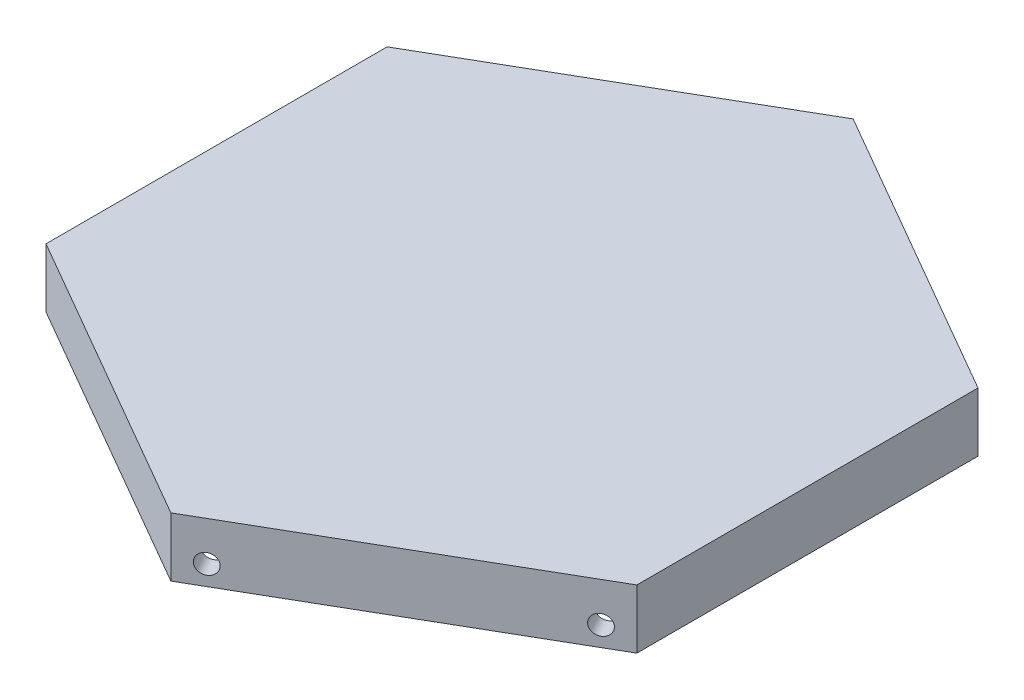
from build123d import *

# Parameters (mm, degrees)
BOSS_EXTRUDE2_DEPTH = 9
CUT_EXTRUDE3_DEPTH  = 6
SKETCH5_R           = 1.5
CUT_EXTRUDE7_DEPTH  = 5
SKETCH7_R           = 1.5
CUT_EXTRUDE8_DEPTH  = 5
SKETCH8_R           = 1.5
CUT_EXTRUDE9_DEPTH  = 5


with BuildPart() as part:
    # Sketch1 → Boss-Extrude2 (new body)
    with BuildSketch(Plane(origin=(0, 0, 0), x_dir=(1, 0, 0), z_dir=(0, 1, 0))):
        Polygon((0, 51.961524227), (-45, 25.980762114), (-45, -25.980762114), (0, -51.961524227), (45, -25.980762114), (45, 25.980762114), align=None)
    extrude(amount=BOSS_EXTRUDE2_DEPTH)

    # Sketch4 → Cut-Extrude3 (cut)
    with BuildSketch(Plane.XZ):
        Polygon((0, 48.497422612), (-42, 24.248711306), (-42, -24.248711306), (0, -48.497422612), (42, -24.248711306), (42, 24.248711306), align=None)
    extrude(amount=-CUT_EXTRUDE3_DEPTH, mode=Mode.SUBTRACT)

    # Sketch5 → Cut-Extrude7 (cut)
    with BuildSketch(Plane.ZY.offset(45)):
        with Locations((-21.980762114, 3)):
            Circle(SKETCH5_R)
        with Locations((21.980762114, 3)):
            Circle(SKETCH5_R)
    extrude(amount=-CUT_EXTRUDE7_DEPTH, mode=Mode.SUBTRACT)

    # Sketch7 → Cut-Extrude8 (cut)
    with BuildSketch(Plane(origin=(22.5, 0, 38.97114317), x_dir=(0.8660254037844346, 0, -0.5000000000000071), z_dir=(0.5000000000000071, 0, 0.8660254037844346))):
        with Locations((-21.980762114, 3)):
            Circle(SKETCH7_R)
        with Locations((21.980762114, 3)):
            Circle(SKETCH7_R)
    extrude(amount=-CUT_EXTRUDE8_DEPTH, mode=Mode.SUBTRACT)

    # Sketch8 → Cut-Extrude9 (cut)
    with BuildSketch(Plane(origin=(22.5, 0, -38.97114317), x_dir=(-0.8660254037844414, 0, -0.49999999999999517), z_dir=(0.49999999999999517, 0, -0.8660254037844414))):
        with Locations((-21.980762114, 3)):
            Circle(SKETCH8_R)
        with Locations((21.980762114, 3)):
            Circle(SKETCH8_R)
    extrude(amount=-CUT_EXTRUDE9_DEPTH, mode=Mode.SUBTRACT)


solid = part.part
